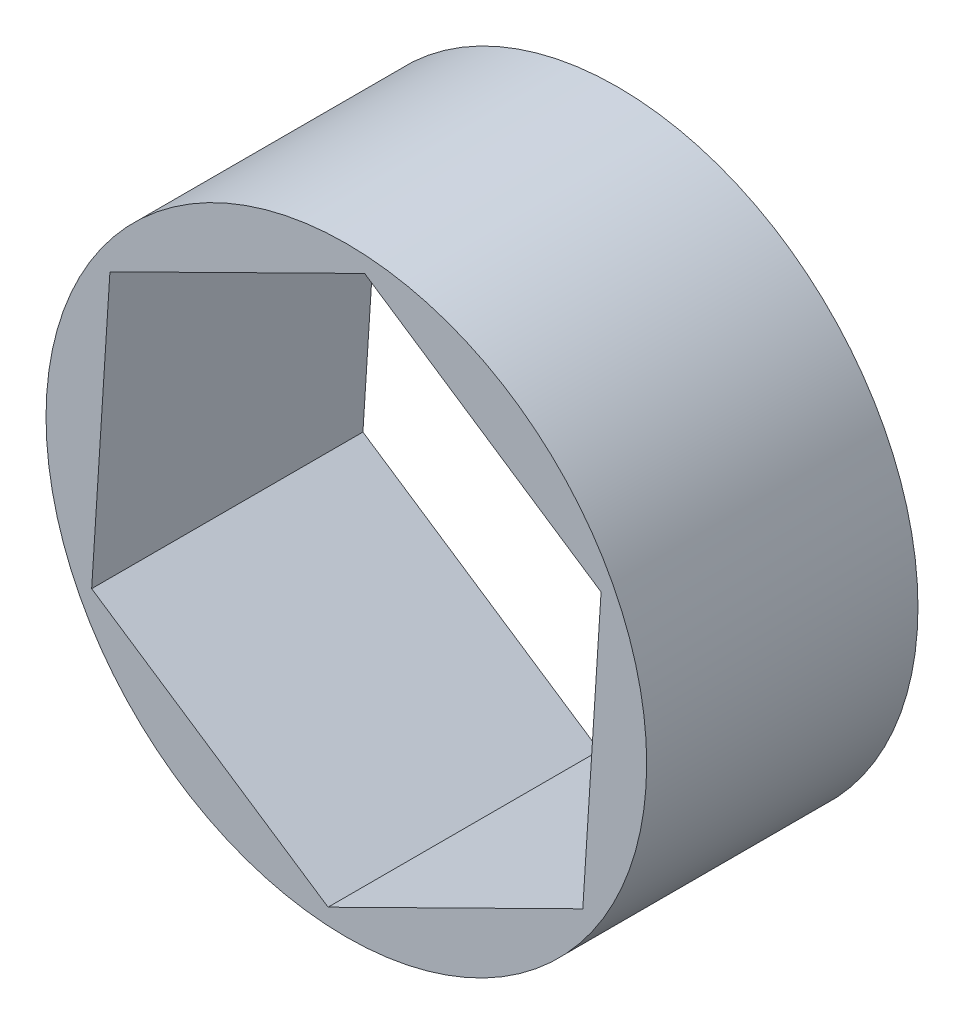
from build123d import *

# Parameters (mm, degrees)
SKETCH1_R           = 7.75
BOSS_EXTRUDE1_DEPTH = 7


with BuildPart() as part:
    # Sketch1 → Boss-Extrude1 (new body)
    with BuildSketch(Plane.XY):
        Circle(SKETCH1_R)
        Polygon((-6.10088266, 4.067255107), (-6.572787576, -3.249891816), (-0.471904916, -7.317146922), (6.10088266, -4.067255107), (6.572787576, 3.249891816), (0.471904916, 7.317146922), align=None, mode=Mode.SUBTRACT)
    extrude(amount=BOSS_EXTRUDE1_DEPTH)


solid = part.part
